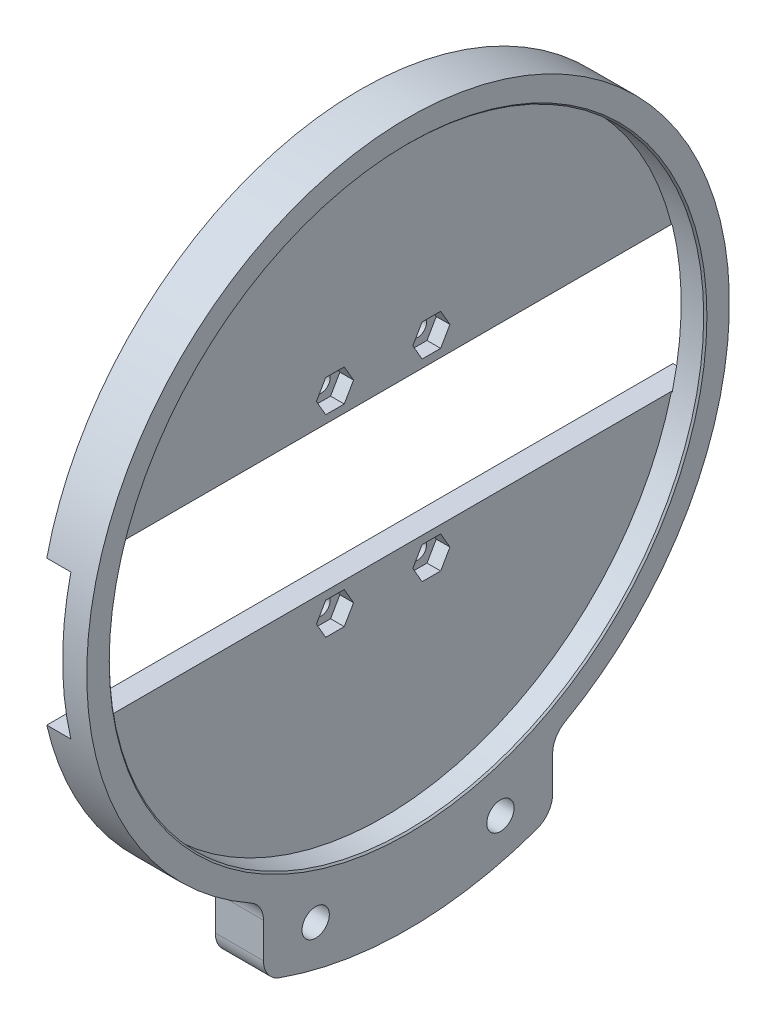
from build123d import *

# Parameters (mm, degrees)
CHAMFER_2_SIZE              = 0.2
CUT_EXTRUDE_START           = -10
CUT_EXTRUDE_1_DEPTH         = 10
HOLE_WIZARD_M31_D           = 3.4
HOLE_WIZARD_M31_CSINK_D     = 6.3
HOLE_WIZARD_M31_CSINK_ANGLE = 90
FILLET_1_R                  = 3
SKETCH_5_W                  = 80
SKETCH_5_H                  = 18
CUT_EXTRUDE_2_DEPTH         = 3
HOLE_WIZARD_M21_D           = 2.2
CUT_EXTRUDE_3_DEPTH         = 1.7


with BuildPart() as part:
    # Эскиз1 → Повернуть1 (revolve)
    with BuildSketch(Plane.XY, mode=Mode.PRIVATE) as revolve_1_sk:
        Polygon((6, 37), (2.9, 37), (2.9, 0), (0, 0), (0, 47.5), (6, 47.5), align=None)
    revolve(revolve_1_sk.sketch.rotate(Axis((-5.881924198, 0, 0), (1, 0, 0)), 90), axis=Axis((-5.881924198, 0, 0), (1, 0, 0)))

    # Фаска2
    chamfer_2_edges = [part.edges().sort_by_distance(p)[0] for p in [
        (6, 0, -37),
    ]]
    chamfer(chamfer_2_edges, length=CHAMFER_2_SIZE)

    # Эскиз2 → Вырез-Вытянуть1 (cut)
    with BuildSketch(Plane.ZY.offset(CUT_EXTRUDE_START)):
        with BuildLine():
            Line((-18, -35.721142199), (-18, -43.957365708))
            ThreePointArc((-18, -43.957365708), (0, 47.5), (18, -43.957365708))
            Line((18, -43.957365708), (18, -35.721142199))
            ThreePointArc((18, -35.721142199), (0, 40), (-18, -35.721142199))
        make_face()
    extrude(amount=CUT_EXTRUDE_1_DEPTH, mode=Mode.SUBTRACT)

    # Зенковка для винта с потайной головкой M31 (through all)
    with Locations(Plane.ZY):
        with Locations((-11.5, -41), (11.5, -41)):
            CounterSinkHole(HOLE_WIZARD_M31_D / 2, HOLE_WIZARD_M31_CSINK_D / 2, counter_sink_angle=HOLE_WIZARD_M31_CSINK_ANGLE)

    # Скругление1
    fillet_1_edges = [part.edges().sort_by_distance(p)[0] for p in [
        (3, -35.721142199, 18),
        (3, -35.721142199, -18),
        (3, -43.957365708, -18),
        (3, -43.957365708, 18),
    ]]
    fillet(fillet_1_edges, radius=FILLET_1_R)

    # Эскиз5 → Вырез-Вытянуть2 (cut)
    with BuildSketch(Plane.ZY):
        Rectangle(SKETCH_5_W, SKETCH_5_H)
    extrude(amount=-CUT_EXTRUDE_2_DEPTH, mode=Mode.SUBTRACT)

    # Отверстие с зазором M21 (through all)
    with Locations(Plane.ZY):
        with Locations((6, 12), (-6, 12), (-6, -12), (6, -12)):
            Hole(HOLE_WIZARD_M21_D / 2)

    # Эскиз8 → Вырез-Вытянуть3 (cut)
    with BuildSketch(Plane(origin=(2.9, 0, 0), x_dir=(0, 0, -1), z_dir=(1, 0, 0))):
        Polygon((7.154700538, 10), (8.309401077, 12), (7.154700538, 14), (4.845299462, 14), (3.690598923, 12), (4.845299462, 10), align=None)
        Polygon((-4.845299462, 10), (-3.690598923, 12), (-4.845299462, 14), (-7.154700538, 14), (-8.309401077, 12), (-7.154700538, 10), align=None)
        Polygon((-4.845299462, -14), (-3.690598923, -12), (-4.845299462, -10), (-7.154700538, -10), (-8.309401077, -12), (-7.154700538, -14), align=None)
        Polygon((7.154700538, -14), (8.309401077, -12), (7.154700538, -10), (4.845299462, -10), (3.690598923, -12), (4.845299462, -14), align=None)
    extrude(amount=-CUT_EXTRUDE_3_DEPTH, mode=Mode.SUBTRACT)


solid = part.part
